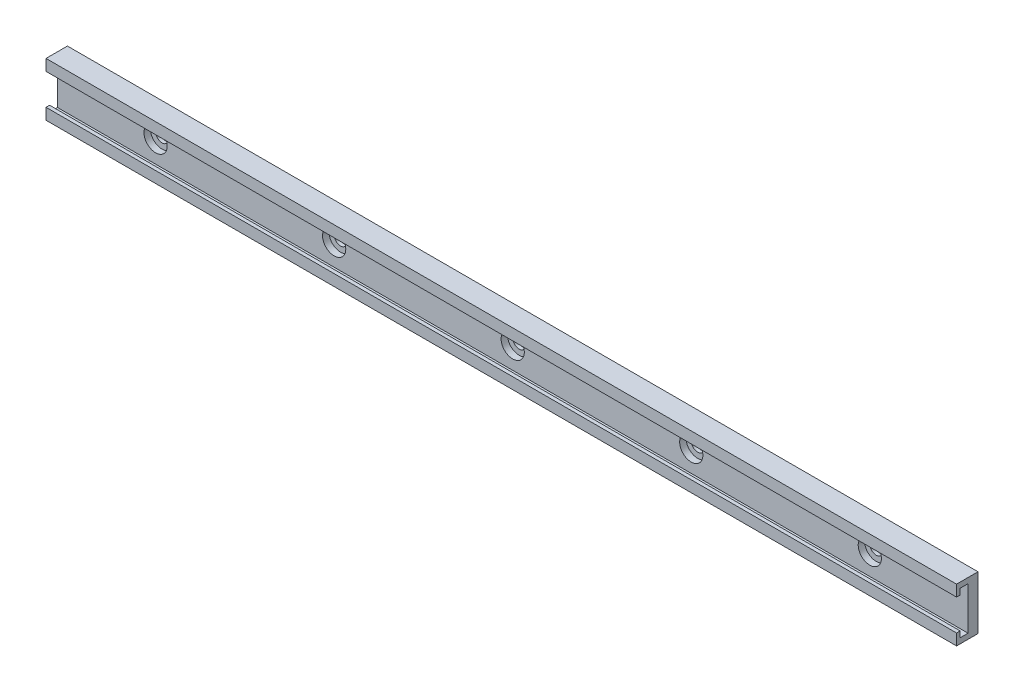
from build123d import *

# Parameters (mm, degrees)
EXTRUDE_1_DEPTH           = 127.5
HOLE_WIZARD_1_D           = 3.5
HOLE_WIZARD_1_CBORE_D     = 6.5
HOLE_WIZARD_1_CBORE_DEPTH = 1.8


with BuildPart() as part:
    # 草图1 → 凸台-拉伸1 (new, symmetric)
    with BuildSketch(Plane(origin=(0, 0, 0), x_dir=(0, 0, -1), z_dir=(1, 0, 0))):
        Polygon((-5, -4.35), (-5, -6), (-2.8, -6), (-2.8, 6), (-5, 6), (-5, 4.35), (-6, 4.35), (-6, 7.5), (0, 7.5), (0, -7.5), (-6, -7.5), (-6, -4.35), align=None)
    extrude(amount=EXTRUDE_1_DEPTH, both=True)

    # 孔1 (through all)
    with Locations(Plane.XY.offset(2.8)):
        with Locations((-100, 0), (-50, 0), (0, 0), (50, 0), (100, 0)):
            CounterBoreHole(HOLE_WIZARD_1_D / 2, HOLE_WIZARD_1_CBORE_D / 2, HOLE_WIZARD_1_CBORE_DEPTH)


solid = part.part
